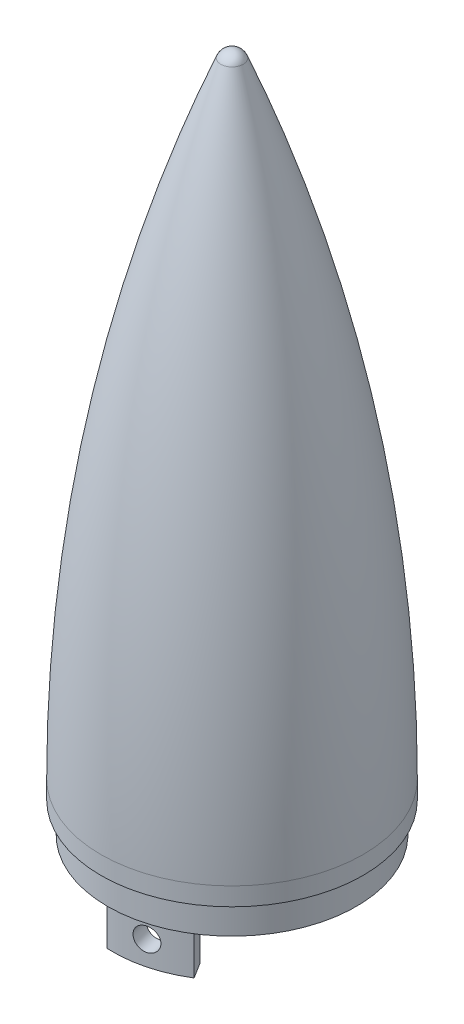
from build123d import *
from build123d.topology import SkipClean

# Parameters (mm, degrees)
SKETCH1_R           = 27.6225
SKETCH1_R_2         = 25.0825
BASE_DEPTH          = 3.81
BOLT_POINT_START    = 15.24
BOLT_POINT_DEPTH    = 27.94
CIRPATTERN2_COUNT   = 2
CHAMFER1_SIZE       = 2.54
CUT_EXTRUDE1_REACH  = 153.429
SKETCH5_R           = 2.413
BOSS_EXTRUDE1_START = 6.35
SKETCH6_R           = 26.2255
SKETCH6_R_2         = 25.0825
BOSS_EXTRUDE1_DEPTH = 6.35


with BuildPart() as part:
    # Sketch1 → base (new body)
    with BuildSketch(Plane(origin=(0, 0, 0), x_dir=(1, 0, 0), z_dir=(0, 1, 0))):
        with Locations(Location((0, 0, 0), (0, 0, 90))):
            Circle(SKETCH1_R)
        with Locations(Location((0, 0, 0), (0, 0, 90))):
            Circle(SKETCH1_R_2, mode=Mode.SUBTRACT)
    extrude(amount=BASE_DEPTH)

    # Sketch4 → Revolve1 (revolve)
    with BuildSketch(Plane(origin=(0, 0, 0), x_dir=(0, 0, -1), z_dir=(1, 0, 0)), mode=Mode.PRIVATE) as revolve1_sk:
        with BuildLine():
            Line((0, 137.048596373), (0, 134.508596373))
            Line((0, 134.508596373), (-2.35955036, 129.098874044))
            ThreePointArc((-2.35955036, 129.098874044), (-19.355801215, 67.476385164), (-25.0825, 3.81))
            Line((-25.0825, 3.81), (-27.6225, 3.81))
            ThreePointArc((-27.6225, 3.81), (-21.249657526, 70.830537494), (-2.35955036, 135.448874044))
            ThreePointArc((-2.35955036, 135.448874044), (-1.425358677, 136.610964714), (0, 137.048596373))
        make_face()
    revolve(revolve1_sk.sketch.rotate(Axis((0, 3.81, 0), (0, 1, 0)), 180), axis=Axis((0, 3.81, 0), (0, 1, 0)))

    # Sketch2 → bolt_point (add)
    with BuildSketch(Plane.XZ.offset(BOLT_POINT_START)):
        with BuildLine():
            Line((11.272707548, 18.040103125), (13.291699945, 21.271166372))
            ThreePointArc((13.291699945, 21.271166372), (6.280156452, 24.28356319), (-1.312716622, 25.048125305))
            Line((-1.312716622, 25.048125305), (-1.113316629, 21.243346778))
            ThreePointArc((-1.113316629, 21.243346778), (5.326208636, 20.59492068), (11.272707548, 18.040103125))
        make_face()
    bolt_point = extrude(amount=-BOLT_POINT_DEPTH)

    # CirPattern2: bolt_point ×2 about axis
    cirpattern2_axis = Axis((0, 0, 0), (0, 1, 0))
    for i in range(1, CIRPATTERN2_COUNT):
        add(bolt_point.rotate(cirpattern2_axis, i * 360 / CIRPATTERN2_COUNT))

    # Chamfer1
    chamfer1_edges = [part.edges().sort_by_distance(p)[0] for p in [
        (5.326208636, 12.7, 20.59492068),
        (-5.326208636, 12.7, -20.59492068),
    ]]
    chamfer(chamfer1_edges, length=CHAMFER1_SIZE)

    # Sketch5 → Cut-Extrude1 (cut, up to next)
    with BuildSketch(Plane(origin=(6.916121662, 0, 26.742658196), x_dir=(0.9681476403781086, 0, -0.25038000405443844), z_dir=(0.2503800040544384, 0, 0.9681476403781085)), mode=Mode.PRIVATE) as cut_extrude1_sk1:
        with Locations((0, -10.16)):
            Circle(SKETCH5_R)
    cut_extrude1_tool1 = extrude(cut_extrude1_sk1.sketch, amount=-CUT_EXTRUDE1_REACH, mode=Mode.PRIVATE) & part.part
    add(cut_extrude1_tool1.solids().sort_by_distance((6.916122, -10.16, 26.742658))[0], mode=Mode.SUBTRACT)
    add(cut_extrude1_tool1.solids().sort_by_distance((6.916122, -10.16, 26.742658))[1], mode=Mode.SUBTRACT)

    # Sketch6 → Boss-Extrude1 (add)
    with SkipClean():  # the faces are left unmerged after this step: merging them gives an invalid solid
        with BuildSketch(Plane.XZ.offset(BOSS_EXTRUDE1_START)):
            with Locations(Location((0, 0, 0), (0, 0, 90))):
                Circle(SKETCH6_R)
            Circle(SKETCH6_R_2, mode=Mode.SUBTRACT)
        extrude(amount=-BOSS_EXTRUDE1_DEPTH)


solid = part.part
